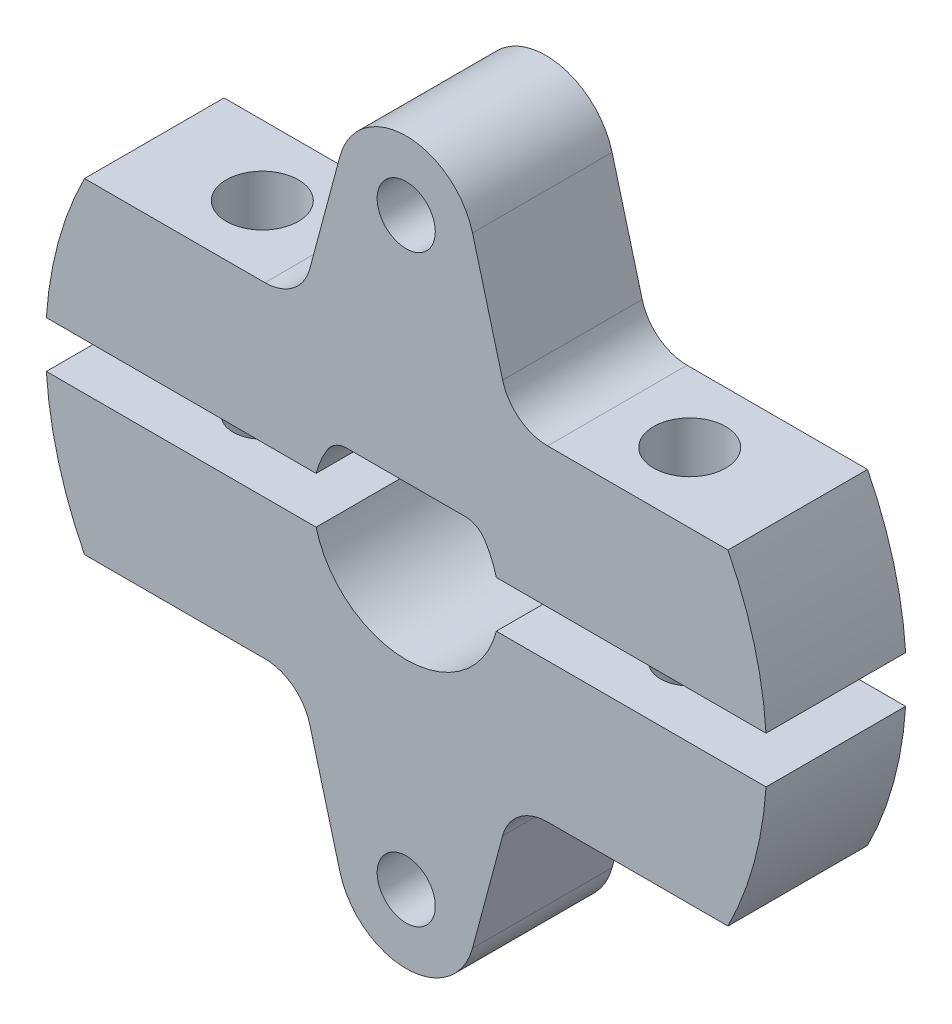
from build123d import *

# Parameters (mm, degrees)
SKETCH_1_R                  = 15.5
EXTRUDE_1_DEPTH             = 3
SKETCH_2_W                  = 35
SKETCH_2_H                  = 2
CUT_EXTRUDE_1_DEPTH         = 24
SKETCH_5_W                  = 1.25
SKETCH_5_H                  = 6
PATTERN_CIRCULAR_1_COUNT    = 2
CUT_EXTRUDE_2_DEPTH         = 54
SKETCH_8_R                  = 1.55
CUT_EXTRUDE_3_DEPTH         = 6
SKETCH_10_W                 = 1.25
SKETCH_10_H                 = 14.5
HOLE_WIZARD_M3_2_AT_2_COUNT = 2
HOLE_WIZARD_M3_2_AT_2_PITCH = 18.370499436
FILLET_2_R                  = 1
CUT_EXTRUDE_4_DEPTH         = 10
FILLET_1_R                  = 2
FILLET_3_R                  = 2


with BuildPart() as part:
    # 草图1 → 凸台-拉伸1 (new, symmetric)
    with BuildSketch(Plane.XY):
        Circle(SKETCH_1_R)
        with BuildLine():
            Line((-3.039736831, 2.6), (3.039736831, 2.6))
            ThreePointArc((3.039736831, 2.6), (0, -4), (-3.039736831, 2.6))
        make_face(mode=Mode.SUBTRACT)
    extrude(amount=EXTRUDE_1_DEPTH, both=True)

    # 草图2 → 切除-拉伸1 (cut, symmetric)
    with BuildSketch(Plane.XY.offset(3)):
        Rectangle(SKETCH_2_W, SKETCH_2_H)
    extrude(amount=CUT_EXTRUDE_1_DEPTH, both=True, mode=Mode.SUBTRACT)


with BuildPart() as cut_extrude_1_piece_1:
    # of the separate pieces the step leaves, piece 1, a body of its own (cut_extrude_1_pieces)
    add(part.part.solids().sort_by_distance((15.467708298, 1, -3))[0])

    # 草图5 → M3 螺纹孔1 (revolve, cut)
    with BuildSketch(Plane(origin=(0, 12.55, 3), x_dir=(0, -1, 0), z_dir=(1, 0, 0))):
        with Locations((0.625, 3)):
            Rectangle(SKETCH_5_W, SKETCH_5_H)
    hole_wizard_m3_1 = revolve(axis=Axis((0, 12.55, 9.35), (0, 0, -1)), mode=Mode.SUBTRACT)

    # 草图7 → 切除-拉伸2 (cut, symmetric)
    with BuildSketch(Plane.XY.offset(3)):
        with BuildLine():
            ThreePointArc((1.3e-08, 15.5), (-8.116341535, 13.20511265), (-13.829316686, 7))
            Line((-13.829316686, 7), (-4.54118275, 7))
            Line((-4.54118275, 7), (-2.849481188, 13.313516183))
            ThreePointArc((-2.849481188, 13.313516183), (-1.79584621, 14.890392358), (1.3e-08, 15.5))
        make_face()
        with BuildLine():
            ThreePointArc((13.829316686, 7), (8.116341546, 13.205112643), (1.3e-08, 15.5))
            ThreePointArc((1.3e-08, 15.5), (1.795846221, 14.89039235), (2.849481188, 13.313516183))
            Line((2.849481188, 13.313516183), (4.54118275, 7))
            Line((4.54118275, 7), (13.829316686, 7))
        make_face()
    extrude(amount=CUT_EXTRUDE_2_DEPTH, both=True, mode=Mode.SUBTRACT)

    # 草图8 → 切除-拉伸3 (cut)
    with BuildSketch(Plane(origin=(0, 7, 0), x_dir=(1, 0, 0), z_dir=(0, 1, 0))):
        with Locations(Location((-9.185249718, 0, 0), (0, 0, 180))):
            Circle(SKETCH_8_R)
        with Locations(Location((9.185249718, 0, 0), (0, 0, 180))):
            Circle(SKETCH_8_R)
    extrude(amount=-CUT_EXTRUDE_3_DEPTH, mode=Mode.SUBTRACT)

    # 圆角2
    fillet_2_edges = [cut_extrude_1_piece_1.edges().sort_by_distance(p)[0] for p in [
        (3.039736831, 2.6, 0),
        (-3.039736831, 2.6, 0),
    ]]
    fillet(fillet_2_edges, radius=FILLET_2_R)

    # 圆角1
    fillet_1_edges = [cut_extrude_1_piece_1.edges().sort_by_distance(p)[0] for p in [
        (-4.54118275, 7, 0),
        (4.54118275, 7, 0),
    ]]
    fillet(fillet_1_edges, radius=FILLET_1_R)


with BuildPart() as cut_extrude_1_piece_2:
    # of the separate pieces the step leaves, piece 2, a body of its own (cut_extrude_1_pieces)
    add(part.part.solids().sort_by_distance((-15.467708298, -1, -3))[0])

    # 阵列(圆周)1: M3 螺纹孔1 ×2 about axis
    pattern_circular_1_axis = Axis((0, 0, 0), (0, 0, 1))
    for i in range(1, PATTERN_CIRCULAR_1_COUNT):
        add(hole_wizard_m3_1.rotate(pattern_circular_1_axis, i * 360 / PATTERN_CIRCULAR_1_COUNT), mode=Mode.SUBTRACT)

    # 草图10 → M3 螺纹孔2 (revolve, cut)
    with BuildSketch(Plane(origin=(-9.185249718, -1, 0), x_dir=(0, 0, 1), z_dir=(1, 0, 0))):
        with Locations((0.625, 7.25)):
            Rectangle(SKETCH_10_W, SKETCH_10_H)
    hole_wizard_m3_2 = revolve(axis=Axis((-9.185249718, 5.35, 0), (0, -1, 0)), mode=Mode.SUBTRACT)

    # M3 螺纹孔2 at 2: M3 螺纹孔2 ×2
    with Locations(*[(i * HOLE_WIZARD_M3_2_AT_2_PITCH, 0, 0) for i in range(1, HOLE_WIZARD_M3_2_AT_2_COUNT)]):
        add(hole_wizard_m3_2, mode=Mode.SUBTRACT)

    # 草图12 → 切除-拉伸4 (cut)
    with BuildSketch(Plane.XY.offset(3)):
        with BuildLine():
            ThreePointArc((-13.829316686, -7), (-8.116341539, -13.205112647), (3e-09, -15.5))
            ThreePointArc((3e-09, -15.5), (-1.795846214, -14.890392355), (-2.849481188, -13.313516183))
            Line((-2.849481188, -13.313516183), (-4.54118275, -7))
            Line((-4.54118275, -7), (-13.829316686, -7))
        make_face()
        with BuildLine():
            ThreePointArc((3e-09, -15.5), (8.116341542, -13.205112645), (13.829316686, -7))
            Line((13.829316686, -7), (4.54118275, -7))
            Line((4.54118275, -7), (2.849481188, -13.313516183))
            ThreePointArc((2.849481188, -13.313516183), (1.795846217, -14.890392353), (3e-09, -15.5))
        make_face()
    extrude(amount=-CUT_EXTRUDE_4_DEPTH, mode=Mode.SUBTRACT)

    # 圆角3
    fillet_3_edges = [cut_extrude_1_piece_2.edges().sort_by_distance(p)[0] for p in [
        (-4.54118275, -7, 0),
        (4.54118275, -7, 0),
    ]]
    fillet(fillet_3_edges, radius=FILLET_3_R)


solid = Compound([cut_extrude_1_piece_1.part, cut_extrude_1_piece_2.part])
